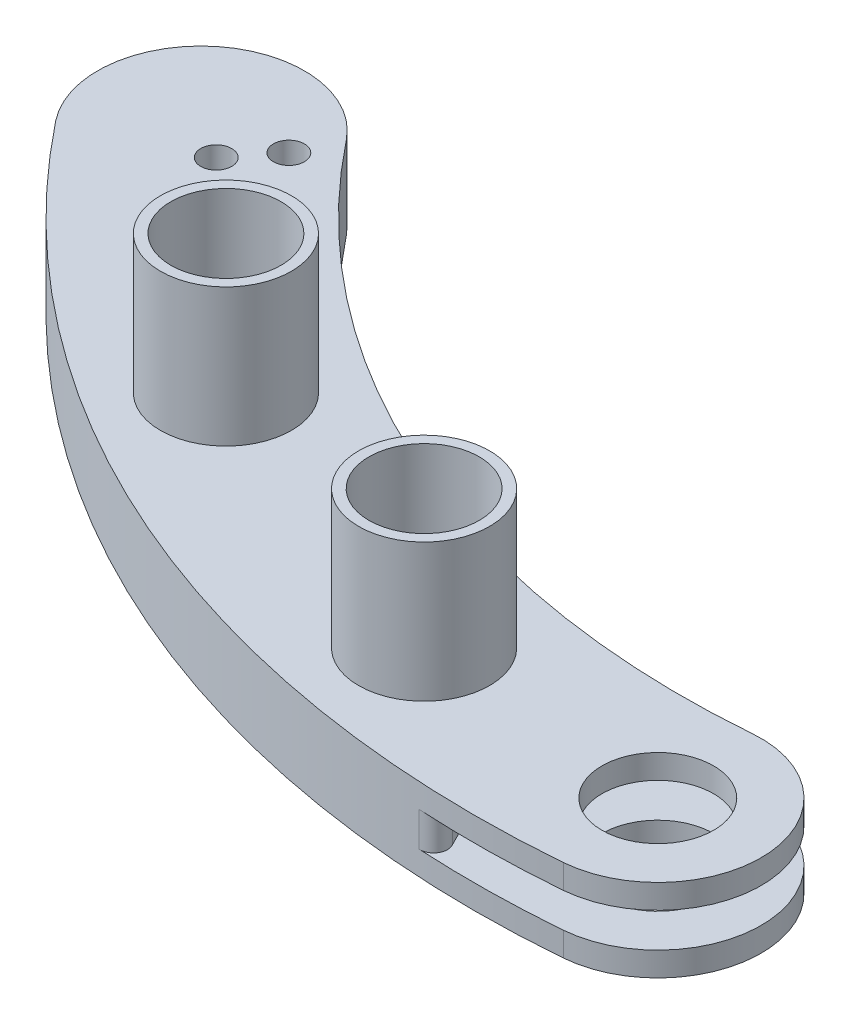
from build123d import *

# Parameters (mm, degrees)
BOSS_EXTRUDE4_DEPTH = 11.999999999999996
BOSS_EXTRUDE5_DEPTH = 3.5
BOSS_EXTRUDE6_DEPTH = 12
CUT_EXTRUDE2_DEPTH  = 8.5
BOSS_EXTRUDE7_DEPTH = 3.5000000000000004
SKETCH2_R           = 8.1
CUT_EXTRUDE3_DEPTH  = 12
FILLET1_R           = 5
FILLET2_R           = 2
SKETCH3_R           = 2.2499999999999964
CUT_EXTRUDE4_DEPTH  = 12
SKETCH4_R           = 9.500000000000002
SKETCH4_R_2         = 8.000000000000002
SKETCH4_R_3         = 9.499999999999995
SKETCH4_R_4         = 7.999999999999998
BOSS_EXTRUDE8_DEPTH = 20


with BuildPart() as part:
    # Sketch1 → Boss-Extrude4 (new body)
    with BuildSketch(Plane(origin=(0, 0, 0), x_dir=(1, 0, 0), z_dir=(0, 1, 0))):
        with BuildLine():
            ThreePointArc((-105.23956914411866, 60.05130546378884), (-126.31086817026393, 62.500868149406244), (-128.76043085588134, 41.429569123260976))
            ThreePointArc((-128.76043085588134, 41.42956912326096), (-78.3921989201775, 0.4513014224205847), (-15.424890802752289, -15.400995588922257))
            ThreePointArc((-15.424890802752284, -15.400995588922251), (-20.878753235246265, -0.5691494549701637), (-16.67921047602729, 14.665420305521598))
            ThreePointArc((-16.679210476027265, 14.665420305521593), (-65.8857769449076, 27.74562513419724), (-105.23956914411866, 60.05130546378885))
        make_face()
    extrude(amount=BOSS_EXTRUDE4_DEPTH)

    # Sketch1<6> → Boss-Extrude5 (add)
    with BuildSketch(Plane(origin=(0, 0, 0), x_dir=(1, 0, 0), z_dir=(0, 1, 0))):
        with BuildLine():
            ThreePointArc((-16.67921047602729, 14.665420305521598), (-20.878753235246265, -0.5691494549701637), (-15.424890802752284, -15.400995588922251))
            ThreePointArc((-15.424890802752289, -15.400995588922257), (-7.086372530747029, -15.406529466177687), (1.2395691441186596, -14.94869453621115))
            ThreePointArc((1.2395691441186607, -14.948694536211157), (14.948694536211152, 1.2395691441186514), (-1.2395691441186483, 14.948694536211152))
            ThreePointArc((-1.2395691441186347, 14.94869453621115), (-8.954828429393212, 14.55844291928571), (-16.679210476027265, 14.665420305521593))
        make_face()
    extrude(amount=BOSS_EXTRUDE5_DEPTH)

    # Sketch1<8> → Boss-Extrude6 (add)
    with BuildSketch(Plane(origin=(0, 0, 0), x_dir=(1, 0, 0), z_dir=(0, 1, 0))):
        with BuildLine():
            ThreePointArc((-16.67921047602729, 14.665420305521598), (-20.878753235246265, -0.5691494549701637), (-15.424890802752284, -15.400995588922251))
            ThreePointArc((-15.424890802752289, -15.400995588922257), (-7.086372530747029, -15.406529466177687), (1.2395691441186596, -14.94869453621115))
            ThreePointArc((1.2395691441186607, -14.948694536211157), (14.948694536211152, 1.2395691441186514), (-1.2395691441186483, 14.948694536211152))
            ThreePointArc((-1.2395691441186347, 14.94869453621115), (-8.954828429393212, 14.55844291928571), (-16.679210476027265, 14.665420305521593))
        make_face()
    extrude(amount=BOSS_EXTRUDE6_DEPTH)

    # Sketch1<9> → Cut-Extrude2 (cut)
    with BuildSketch(Plane(origin=(0, 0, 0), x_dir=(1, 0, 0), z_dir=(0, 1, 0))):
        with BuildLine():
            ThreePointArc((-16.67921047602729, 14.665420305521598), (-20.878753235246265, -0.5691494549701637), (-15.424890802752284, -15.400995588922251))
            ThreePointArc((-15.424890802752289, -15.400995588922257), (-7.086372530747029, -15.406529466177687), (1.2395691441186596, -14.94869453621115))
            ThreePointArc((1.2395691441186607, -14.948694536211157), (14.948694536211152, 1.2395691441186514), (-1.2395691441186483, 14.948694536211152))
            ThreePointArc((-1.2395691441186347, 14.94869453621115), (-8.954828429393212, 14.55844291928571), (-16.679210476027265, 14.665420305521593))
        make_face()
    extrude(amount=CUT_EXTRUDE2_DEPTH, mode=Mode.SUBTRACT)

    # Sketch1<10> → Boss-Extrude7 (add)
    with BuildSketch(Plane(origin=(0, 0, 0), x_dir=(1, 0, 0), z_dir=(0, 1, 0))):
        with BuildLine():
            ThreePointArc((-16.67921047602729, 14.665420305521598), (-20.878753235246265, -0.5691494549701637), (-15.424890802752284, -15.400995588922251))
            ThreePointArc((-15.424890802752289, -15.400995588922257), (-7.086372530747029, -15.406529466177687), (1.2395691441186596, -14.94869453621115))
            ThreePointArc((1.2395691441186607, -14.948694536211157), (14.948694536211152, 1.2395691441186514), (-1.2395691441186483, 14.948694536211152))
            ThreePointArc((-1.2395691441186347, 14.94869453621115), (-8.954828429393212, 14.55844291928571), (-16.679210476027265, 14.665420305521593))
        make_face()
    extrude(amount=BOSS_EXTRUDE7_DEPTH)

    # Sketch2 → Cut-Extrude3 (cut)
    with BuildSketch(Plane(origin=(0, 11.999999999999996, 0), x_dir=(1, 0, 0), z_dir=(0, 1, 0))):
        Circle(SKETCH2_R)
    extrude(amount=-CUT_EXTRUDE3_DEPTH, mode=Mode.SUBTRACT)

    # Fillet1
    fillet1_edges = [part.edges().sort_by_distance(p)[0] for p in [
        (-16.67921047602728, 6, -14.665420305521597),
    ]]
    fillet(fillet1_edges, radius=FILLET1_R)

    # Fillet2
    fillet2_edges = [part.edges().sort_by_distance(p)[0] for p in [
        (-15.424890802752289, 6, 15.400995588922266),
    ]]
    fillet(fillet2_edges, radius=FILLET2_R)

    # Sketch3 → Cut-Extrude4 (cut)
    with BuildSketch(Plane(origin=(0, 11.999999999999996, 0), x_dir=(1, 0, 0), z_dir=(0, 1, 0))):
        with Locations((-107.81660725396851, 54.30249040498051)):
            Circle(SKETCH3_R)
        with Locations((-112.49908312253997, 48.44378579216329)):
            Circle(SKETCH3_R)
    extrude(amount=-CUT_EXTRUDE4_DEPTH, mode=Mode.SUBTRACT)

    # Sketch4 → Boss-Extrude8 (add)
    # profile 1 of 2: a face of its own
    with BuildSketch(Plane(origin=(0, 11.999999999999996, 0), x_dir=(1, 0, 0), z_dir=(0, 1, 0))):
        with Locations((-35.824132830362714, 1.9278264844930209)):
            Circle(SKETCH4_R)
        with Locations((-35.824132830362714, 1.9278264844930209)):
            Circle(SKETCH4_R_2, mode=Mode.SUBTRACT)
    # profile 2 of 2: a face of its own
    with BuildSketch(Plane(origin=(0, 11.999999999999996, 0), x_dir=(1, 0, 0), z_dir=(0, 1, 0))):
        with Locations((-82.24716798080135, 19.60428986869888)):
            Circle(SKETCH4_R_3)
        with Locations((-82.24716798080135, 19.60428986869888)):
            Circle(SKETCH4_R_4, mode=Mode.SUBTRACT)
    extrude(amount=BOSS_EXTRUDE8_DEPTH)


solid = part.part
